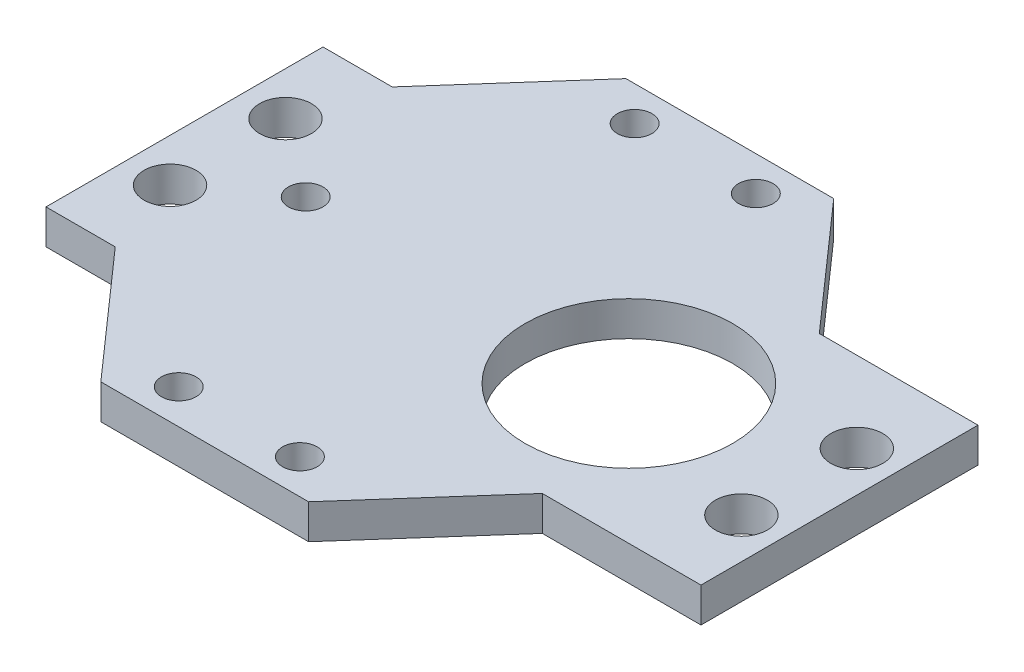
from build123d import *

# Parameters (mm, degrees)
BOSS_EXTRUDE1_DEPTH = 3
SKETCH2_R           = 9
SKETCH2_R_2         = 1.5
CUT_EXTRUDE1_DEPTH  = 3
SKETCH3_R           = 1.5
CUT_EXTRUDE2_DEPTH  = 12
SKETCH4_R           = 2.25
CUT_EXTRUDE3_DEPTH  = 27
SKETCH5_R           = 0.619378792
CUT_EXTRUDE4_DEPTH  = 1


with BuildPart() as part:
    # Sketch1 → Boss-Extrude1 (new body)
    with BuildSketch(Plane(origin=(0, 0, 0), x_dir=(1, 0, 0), z_dir=(0, 1, 0))):
        Polygon((9, 0), (-9, 0), (-18.5, 10.75), (-24.5, 10.75), (-24.5, 34.75), (-18.5, 34.75), (-9, 45.5), (9, 45.5), (18.5, 34.75), (32.25, 34.75), (32.25, 10.75), (18.5, 10.75), align=None)
    extrude(amount=BOSS_EXTRUDE1_DEPTH)

    # Sketch2 → Cut-Extrude1 (cut)
    with BuildSketch(Plane(origin=(0, 3, 0), x_dir=(1, 0, 0), z_dir=(0, 1, 0))):
        with Locations(Location((14, 22.75, 0), (0, 0, 270))):
            Circle(SKETCH2_R)
        with Locations(Location((-14, 22.75, 0), (0, 0, 270))):
            Circle(SKETCH2_R_2)
    extrude(amount=-CUT_EXTRUDE1_DEPTH, mode=Mode.SUBTRACT)

    # Sketch3 → Cut-Extrude2 (cut)
    with BuildSketch(Plane(origin=(0, 0, 0), x_dir=(1, 0, 0), z_dir=(0, 1, 0))):
        with Locations(Location((-5.25, 42.5, 0), (0, 0, 90))):
            Circle(SKETCH3_R)
        with Locations(Location((5.25, 42.5, 0), (0, 0, 90))):
            Circle(SKETCH3_R)
        with Locations(Location((5.25, 3, 0), (0, 0, 90))):
            Circle(SKETCH3_R)
        with Locations(Location((-5.25, 3, 0), (0, 0, 90))):
            Circle(SKETCH3_R)
    extrude(amount=CUT_EXTRUDE2_DEPTH, mode=Mode.SUBTRACT)

    # Sketch4 → Cut-Extrude3 (cut)
    with BuildSketch(Plane(origin=(0, 0, 0), x_dir=(1, 0, 0), z_dir=(0, 1, 0))):
        with Locations(Location((-20.75, 27.75, 0), (0, 0, 90))):
            Circle(SKETCH4_R)
        with Locations(Location((-20.75, 17.75, 0), (0, 0, 90))):
            Circle(SKETCH4_R)
        with Locations(Location((28.749486719, 17.75, 0), (0, 0, 90))):
            Circle(SKETCH4_R)
        with Locations(Location((28.749486719, 27.75, 0), (0, 0, 90))):
            Circle(SKETCH4_R)
    extrude(amount=CUT_EXTRUDE3_DEPTH, mode=Mode.SUBTRACT)

    # Sketch5 → Cut-Extrude4 (cut)
    with BuildSketch(Plane(origin=(0, 0, -45.5), x_dir=(-1, 0, 0), z_dir=(0, 0, -1))):
        with Locations((0, 1.5)):
            Circle(SKETCH5_R)
    extrude(amount=-CUT_EXTRUDE4_DEPTH, mode=Mode.SUBTRACT)


solid = part.part
